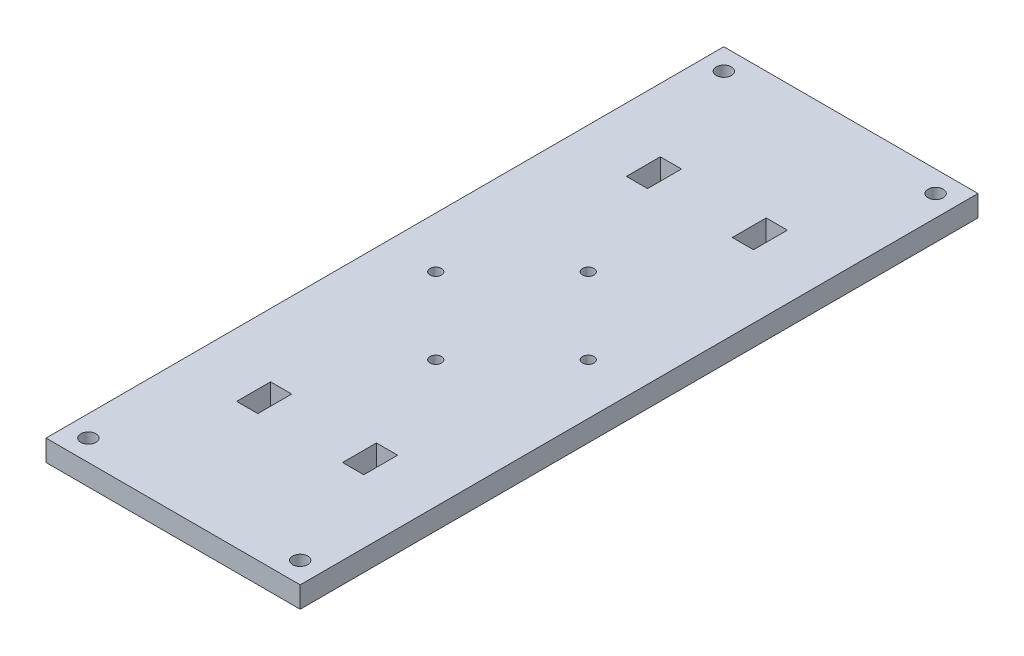
from build123d import *

# Parameters (mm, degrees)
SKETCH1_W           = 60
SKETCH1_H           = 160
BOSS_EXTRUDE1_DEPTH = 5
SKETCH2_R           = 1.78
CUT_EXTRUDE1_DEPTH  = 100.9750816
SKETCH3_R           = 1.35
CUT_EXTRUDE2_DEPTH  = 100.9750816
SKETCH4_W           = 5
SKETCH4_H           = 8
CUT_EXTRUDE3_DEPTH  = 100.9750816


with BuildPart() as part:
    # Sketch1 → Boss-Extrude1 (new body)
    with BuildSketch(Plane(origin=(0, 0, 0), x_dir=(1, 0, 0), z_dir=(0, 1, 0))):
        with Locations((7.29281768, -12.624309392)):
            Rectangle(SKETCH1_W, SKETCH1_H)
    extrude(amount=BOSS_EXTRUDE1_DEPTH)

    # Sketch2 → Cut-Extrude1 (cut, through all)
    with BuildSketch(Plane(origin=(0, 5, 0), x_dir=(1, 0, 0), z_dir=(0, 1, 0))):
        with Locations(Location((-17.70718232, 62.375690608, 0), (0, 0, 270))):
            Circle(SKETCH2_R)
        with Locations(Location((32.29281768, 62.375690608, 0), (0, 0, 270))):
            Circle(SKETCH2_R)
        with Locations(Location((32.29281768, -87.624309392, 0), (0, 0, 270))):
            Circle(SKETCH2_R)
        with Locations(Location((-17.70718232, -87.624309392, 0), (0, 0, 270))):
            Circle(SKETCH2_R)
    extrude(amount=-CUT_EXTRUDE1_DEPTH, mode=Mode.SUBTRACT)

    # Sketch3 → Cut-Extrude2 (cut, through all)
    with BuildSketch(Plane(origin=(0, 5, 0), x_dir=(1, 0, 0), z_dir=(0, 1, 0))):
        with Locations(Location((25.29281768, -12.624309392, 0), (0, 0, 270))):
            Circle(SKETCH3_R)
        with Locations(Location((-10.70718232, -12.624309392, 0), (0, 0, 270))):
            Circle(SKETCH3_R)
        with Locations(Location((7.29281768, 5.375690608, 0), (0, 0, 270))):
            Circle(SKETCH3_R)
        with Locations(Location((7.29281768, -30.624309392, 0), (0, 0, 270))):
            Circle(SKETCH3_R)
    extrude(amount=-CUT_EXTRUDE2_DEPTH, mode=Mode.SUBTRACT)

    # Sketch4 → Cut-Extrude3 (cut, through all)
    with BuildSketch(Plane(origin=(0, 5, 0), x_dir=(1, 0, 0), z_dir=(0, 1, 0))):
        with Locations((-5.20718232, 33.375690608)):
            Rectangle(SKETCH4_W, SKETCH4_H)
        with Locations((19.79281768, 33.375690608)):
            Rectangle(SKETCH4_W, SKETCH4_H)
        with Locations((19.79281768, -58.624309392)):
            Rectangle(SKETCH4_W, SKETCH4_H)
        with Locations((-5.20718232, -58.624309392)):
            Rectangle(SKETCH4_W, SKETCH4_H)
    extrude(amount=-CUT_EXTRUDE3_DEPTH, mode=Mode.SUBTRACT)


solid = part.part
